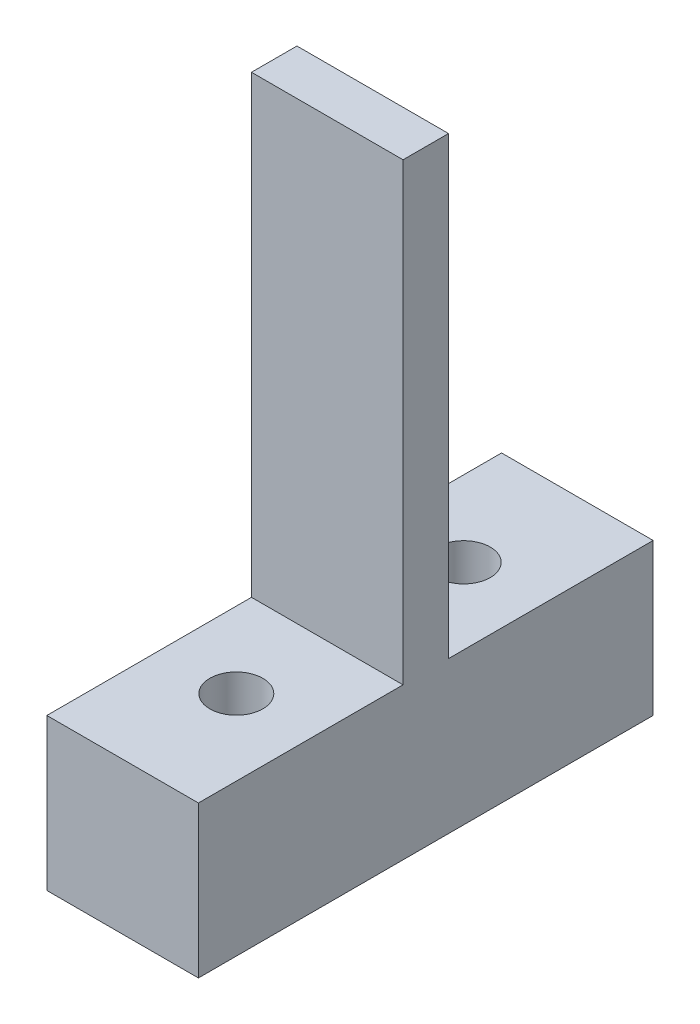
from build123d import *

# Parameters (mm, degrees)
SKETCH2_W           = 10
SKETCH2_H           = 30
SKETCH2_R           = 1.75
BOSS_EXTRUDE1_DEPTH = 10
SKETCH4_W           = 10
SKETCH4_H           = 1.5
BOSS_EXTRUDE3_DEPTH = 30


with BuildPart() as part:
    # Sketch2 → Boss-Extrude1 (new body)
    with BuildSketch(Plane(origin=(0, 0, 0), x_dir=(1, 0, 0), z_dir=(0, 1, 0))):
        with Locations((-41.876032971, 5.874496677)):
            Rectangle(SKETCH2_W, SKETCH2_H)
        with Locations(Location((-41.876032971, -1.625503323, 0), (0, 0, 270))):
            Circle(SKETCH2_R, mode=Mode.SUBTRACT)
        with Locations(Location((-41.876032971, 13.374496677, 0), (0, 0, 270))):
            Circle(SKETCH2_R, mode=Mode.SUBTRACT)
    extrude(amount=BOSS_EXTRUDE1_DEPTH)

    # Sketch4 → Boss-Extrude3 (add)
    with BuildSketch(Plane(origin=(0, 10, 0), x_dir=(1, 0, 0), z_dir=(0, 1, 0))):
        with Locations((-41.876032971, 6.624496677)):
            Rectangle(SKETCH4_W, SKETCH4_H)
        with Locations((-41.876032971, 5.124496677)):
            Rectangle(SKETCH4_W, SKETCH4_H)
    extrude(amount=BOSS_EXTRUDE3_DEPTH)


solid = part.part
